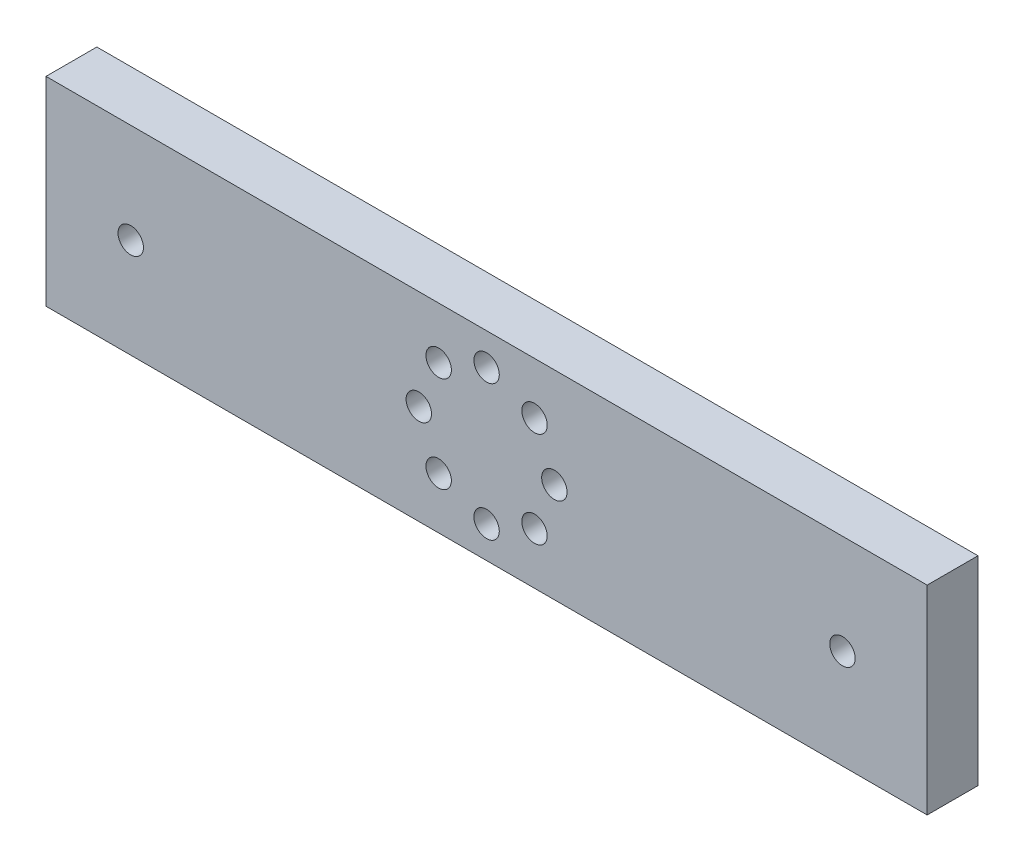
from build123d import *

# Parameters (mm, degrees)
SKETCH_1_W      = 208
SKETCH_1_H      = 47
SKETCH_1_R      = 3
EXTRUDE_1_DEPTH = 12


with BuildPart() as part:
    # 草图1 → 凸台-拉伸1 (new body)
    with BuildSketch(Plane.XY):
        Rectangle(SKETCH_1_W, SKETCH_1_H)
        with Locations((16, 0)):
            Circle(SKETCH_1_R, mode=Mode.SUBTRACT)
        with Locations((11.313708499, -11.313708499)):
            Circle(SKETCH_1_R, mode=Mode.SUBTRACT)
        with Locations((0, -16)):
            Circle(SKETCH_1_R, mode=Mode.SUBTRACT)
        with Locations((-11.313708499, -11.313708499)):
            Circle(SKETCH_1_R, mode=Mode.SUBTRACT)
        with Locations((-16, 0)):
            Circle(SKETCH_1_R, mode=Mode.SUBTRACT)
        with Locations((-11.313708499, 11.313708499)):
            Circle(SKETCH_1_R, mode=Mode.SUBTRACT)
        with Locations((0, 16)):
            Circle(SKETCH_1_R, mode=Mode.SUBTRACT)
        with Locations((11.313708499, 11.313708499)):
            Circle(SKETCH_1_R, mode=Mode.SUBTRACT)
        with Locations((-84, 0)):
            Circle(SKETCH_1_R, mode=Mode.SUBTRACT)
        with Locations((84, 0)):
            Circle(SKETCH_1_R, mode=Mode.SUBTRACT)
    extrude(amount=EXTRUDE_1_DEPTH)


solid = part.part
